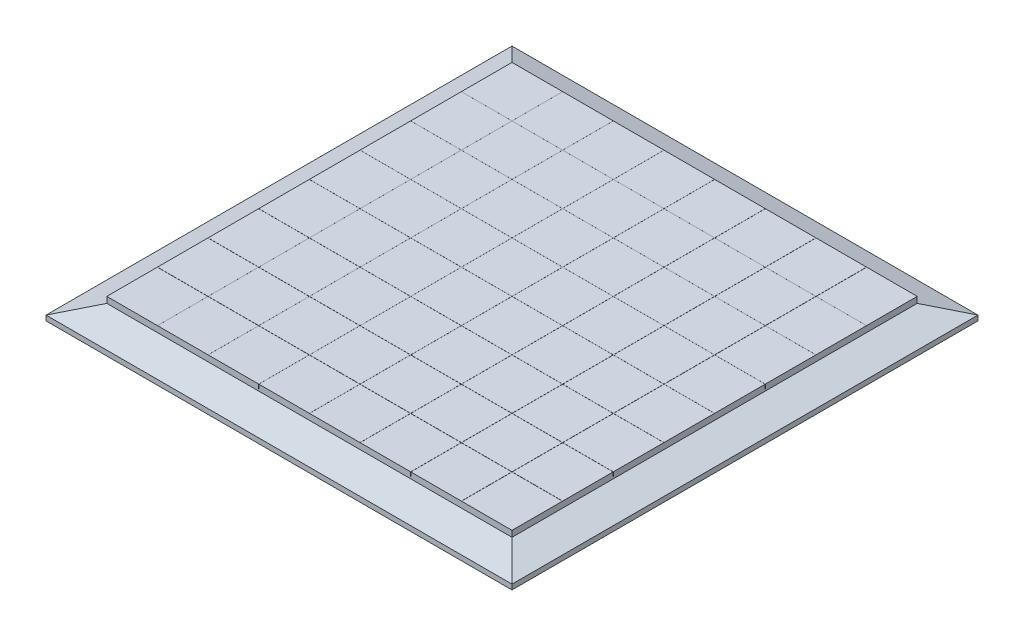
from build123d import *
from OCP.BRepFilletAPI import BRepFilletAPI_MakeChamfer

# Parameters (mm, degrees)
IZIM1_W                     = 460
IZIM1_H                     = 460
Y_KSEKLIK_EKSTR_ZYON1_DEPTH = 15
PAH1_SIZE                   = 10
PAH1_SIZE2                  = 30
IZIM3_W                     = 400
IZIM3_H                     = 400
Y_KSEKLIK_EKSTR_ZYON2_DEPTH = 2
IZIM4_W                     = 49.98
IZIM4_H                     = 50
IZIM4_W_2                   = 50
IZIM4_H_2                   = 49.98
IZIM4_H_3                   = 49.94
IZIM4_H_4                   = 49.96
IZIM4_W_3                   = 49.96
IZIM4_W_4                   = 49.94
IZIM4_H_5                   = 49.9
IZIM4_H_6                   = 49.92
IZIM4_W_5                   = 49.92
IZIM4_W_6                   = 49.9
IZIM4_W_7                   = 49.86
IZIM4_W_8                   = 49.88
IZIM4_H_7                   = 49.88
IZIM4_H_8                   = 49.86
Y_KSEKLIK_EKSTR_ZYON6_DEPTH = 4
IZIM5_W                     = 50
IZIM5_H                     = 50
IZIM5_W_2                   = 49.98
IZIM5_H_2                   = 49.98
IZIM5_W_3                   = 49.96
IZIM5_W_4                   = 49.92
IZIM5_W_5                   = 49.94
IZIM5_H_3                   = 49.96
IZIM5_H_4                   = 49.94
IZIM5_H_5                   = 49.92
IZIM5_W_6                   = 49.9
IZIM5_W_7                   = 49.88
IZIM5_W_8                   = 49.86
IZIM5_H_6                   = 49.9
IZIM5_H_7                   = 49.88
IZIM5_H_8                   = 49.86
Y_KSEKLIK_EKSTR_ZYON7_DEPTH = 3.999


with BuildPart() as part:
    # Çizim1 → Yükseklik-Ekstrüzyon1 (new body)
    with BuildSketch(Plane(origin=(0, 0, 0), x_dir=(1, 0, 0), z_dir=(0, 1, 0))):
        Rectangle(IZIM1_W, IZIM1_H)
    extrude(amount=Y_KSEKLIK_EKSTR_ZYON1_DEPTH)

    # Pah1: one chamfer whose edges measure the first distance from different faces: ONE call of the kernel's chamfer builder (chamfer() names one face for all edges)
    pah1_edges_1 = [part.edges().sort_by_distance(p)[0] for p in [
        (-230, 15, 0),
    ]]
    pah1_side_1 = [part.faces().sort_by_distance(p)[0] for p in [
        (-230, 7.5, 0),
    ]]
    pah1_edges_2 = [part.edges().sort_by_distance(p)[0] for p in [
        (0, 15, 230),
    ]]
    pah1_side_2 = [part.faces().sort_by_distance(p)[0] for p in [
        (0, 7.5, 230),
    ]]
    pah1_edges_3 = [part.edges().sort_by_distance(p)[0] for p in [
        (230, 15, 0),
    ]]
    pah1_side_3 = [part.faces().sort_by_distance(p)[0] for p in [
        (230, 7.5, 0),
    ]]
    pah1_edges_4 = [part.edges().sort_by_distance(p)[0] for p in [
        (0, 15, -230),
    ]]
    pah1_side_4 = [part.faces().sort_by_distance(p)[0] for p in [
        (0, 7.5, -230),
    ]]
    pah1 = BRepFilletAPI_MakeChamfer(part.part.solid().wrapped)
    for e in pah1_edges_1:
        pah1.Add(PAH1_SIZE, PAH1_SIZE2, e.wrapped, pah1_side_1[0].wrapped)  # the first distance lies on this face
    for e in pah1_edges_2:
        pah1.Add(PAH1_SIZE, PAH1_SIZE2, e.wrapped, pah1_side_2[0].wrapped)  # the first distance lies on this face
    for e in pah1_edges_3:
        pah1.Add(PAH1_SIZE, PAH1_SIZE2, e.wrapped, pah1_side_3[0].wrapped)  # the first distance lies on this face
    for e in pah1_edges_4:
        pah1.Add(PAH1_SIZE, PAH1_SIZE2, e.wrapped, pah1_side_4[0].wrapped)  # the first distance lies on this face
    add(Compound.cast(pah1.Shape()), mode=Mode.REPLACE)

    # Çizim3 → Yükseklik-Ekstrüzyon2 (add)
    with BuildSketch(Plane(origin=(0, 15, 0), x_dir=(1, 0, 0), z_dir=(0, 1, 0))):
        Rectangle(IZIM3_W, IZIM3_H)
    extrude(amount=Y_KSEKLIK_EKSTR_ZYON2_DEPTH)

    # Çizim4 → Yükseklik-Ekstrüzyon6 (add)
    with BuildSketch(Plane(origin=(0, 17, 0), x_dir=(1, 0, 0), z_dir=(0, 1, 0))):
        with Locations((-124.99, 175)):
            Rectangle(IZIM4_W, IZIM4_H)
        with Locations((-175, 124.99)):
            Rectangle(IZIM4_W_2, IZIM4_H_2)
        with Locations((-175, 24.97)):
            Rectangle(IZIM4_W_2, IZIM4_H_3)
        with Locations((-124.99, 74.98)):
            Rectangle(IZIM4_W, IZIM4_H_4)
        with Locations((-74.98, 124.99)):
            Rectangle(IZIM4_W_3, IZIM4_H_2)
        with Locations((-24.97, 175)):
            Rectangle(IZIM4_W_4, IZIM4_H)
        with Locations((-175, -75.05)):
            Rectangle(IZIM4_W_2, IZIM4_H_5)
        with Locations((-124.99, -25.04)):
            Rectangle(IZIM4_W, IZIM4_H_6)
        with Locations((-74.98, 24.97)):
            Rectangle(IZIM4_W_3, IZIM4_H_3)
        with Locations((-24.97, 74.98)):
            Rectangle(IZIM4_W_4, IZIM4_H_4)
        with Locations((25.04, 124.99)):
            Rectangle(IZIM4_W_5, IZIM4_H_2)
        with Locations((75.05, 175)):
            Rectangle(IZIM4_W_6, IZIM4_H)
        with Locations((175.07, 175)):
            Rectangle(IZIM4_W_7, IZIM4_H)
        with Locations((125.06, 124.99)):
            Rectangle(IZIM4_W_8, IZIM4_H_2)
        with Locations((75.05, 74.98)):
            Rectangle(IZIM4_W_6, IZIM4_H_4)
        with Locations((25.04, 24.97)):
            Rectangle(IZIM4_W_5, IZIM4_H_3)
        with Locations((-24.97, -25.04)):
            Rectangle(IZIM4_W_4, IZIM4_H_6)
        with Locations((-74.98, -75.05)):
            Rectangle(IZIM4_W_3, IZIM4_H_5)
        with Locations((-124.99, -125.06)):
            Rectangle(IZIM4_W, IZIM4_H_7)
        with Locations((-175, -175.07)):
            Rectangle(IZIM4_W_2, IZIM4_H_8)
        with Locations((-74.98, -175.07)):
            Rectangle(IZIM4_W_3, IZIM4_H_8)
        with Locations((-24.97, -125.06)):
            Rectangle(IZIM4_W_4, IZIM4_H_7)
        with Locations((25.04, -75.05)):
            Rectangle(IZIM4_W_5, IZIM4_H_5)
        with Locations((75.05, -25.04)):
            Rectangle(IZIM4_W_6, IZIM4_H_6)
        with Locations((125.06, 24.97)):
            Rectangle(IZIM4_W_8, IZIM4_H_3)
        with Locations((175.07, 74.98)):
            Rectangle(IZIM4_W_7, IZIM4_H_4)
        with Locations((175.07, -25.04)):
            Rectangle(IZIM4_W_7, IZIM4_H_6)
        with Locations((125.06, -75.05)):
            Rectangle(IZIM4_W_8, IZIM4_H_5)
        with Locations((75.05, -125.06)):
            Rectangle(IZIM4_W_6, IZIM4_H_7)
        with Locations((25.04, -175.07)):
            Rectangle(IZIM4_W_5, IZIM4_H_8)
        with Locations((125.06, -175.07)):
            Rectangle(IZIM4_W_8, IZIM4_H_8)
        with Locations((175.07, -125.06)):
            Rectangle(IZIM4_W_7, IZIM4_H_7)
    extrude(amount=Y_KSEKLIK_EKSTR_ZYON6_DEPTH)

    # Çizim5 → Yükseklik-Ekstrüzyon7 (add)
    with BuildSketch(Plane(origin=(0, 17, 0), x_dir=(1, 0, 0), z_dir=(0, 1, 0))):
        with Locations((-175, 175)):
            Rectangle(IZIM5_W, IZIM5_H)
        with Locations((-124.99, 124.99)):
            Rectangle(IZIM5_W_2, IZIM5_H_2)
        with Locations((-74.98, 175)):
            Rectangle(IZIM5_W_3, IZIM5_H)
        with Locations((25.04, 175)):
            Rectangle(IZIM5_W_4, IZIM5_H)
        with Locations((-24.97, 124.99)):
            Rectangle(IZIM5_W_5, IZIM5_H_2)
        with Locations((-74.98, 74.98)):
            Rectangle(IZIM5_W_3, IZIM5_H_3)
        with Locations((-175, 74.98)):
            Rectangle(IZIM5_W, IZIM5_H_3)
        with Locations((-124.99, 24.97)):
            Rectangle(IZIM5_W_2, IZIM5_H_4)
        with Locations((-74.98, -25.04)):
            Rectangle(IZIM5_W_3, IZIM5_H_5)
        with Locations((-24.97, 24.97)):
            Rectangle(IZIM5_W_5, IZIM5_H_4)
        with Locations((25.04, 74.98)):
            Rectangle(IZIM5_W_4, IZIM5_H_3)
        with Locations((75.05, 124.99)):
            Rectangle(IZIM5_W_6, IZIM5_H_2)
        with Locations((125.06, 175)):
            Rectangle(IZIM5_W_7, IZIM5_H)
        with Locations((175.07, 124.99)):
            Rectangle(IZIM5_W_8, IZIM5_H_2)
        with Locations((125.06, 74.98)):
            Rectangle(IZIM5_W_7, IZIM5_H_3)
        with Locations((75.05, 24.97)):
            Rectangle(IZIM5_W_6, IZIM5_H_4)
        with Locations((25.04, -25.04)):
            Rectangle(IZIM5_W_4, IZIM5_H_5)
        with Locations((-24.97, -75.05)):
            Rectangle(IZIM5_W_5, IZIM5_H_6)
        with Locations((-74.98, -125.06)):
            Rectangle(IZIM5_W_3, IZIM5_H_7)
        with Locations((-124.99, -75.05)):
            Rectangle(IZIM5_W_2, IZIM5_H_6)
        with Locations((-175, -25.04)):
            Rectangle(IZIM5_W, IZIM5_H_5)
        with Locations((-175, -125.06)):
            Rectangle(IZIM5_W, IZIM5_H_7)
        with Locations((-124.99, -175.07)):
            Rectangle(IZIM5_W_2, IZIM5_H_8)
        with Locations((-24.97, -175.07)):
            Rectangle(IZIM5_W_5, IZIM5_H_8)
        with Locations((25.04, -125.06)):
            Rectangle(IZIM5_W_4, IZIM5_H_7)
        with Locations((75.05, -75.05)):
            Rectangle(IZIM5_W_6, IZIM5_H_6)
        with Locations((75.05, -175.07)):
            Rectangle(IZIM5_W_6, IZIM5_H_8)
        with Locations((125.06, -125.06)):
            Rectangle(IZIM5_W_7, IZIM5_H_7)
        with Locations((175.07, -175.07)):
            Rectangle(IZIM5_W_8, IZIM5_H_8)
        with Locations((175.07, -75.05)):
            Rectangle(IZIM5_W_8, IZIM5_H_6)
        with Locations((125.06, -25.04)):
            Rectangle(IZIM5_W_7, IZIM5_H_5)
        with Locations((175.07, 24.97)):
            Rectangle(IZIM5_W_8, IZIM5_H_4)
    extrude(amount=Y_KSEKLIK_EKSTR_ZYON7_DEPTH)


solid = part.part
